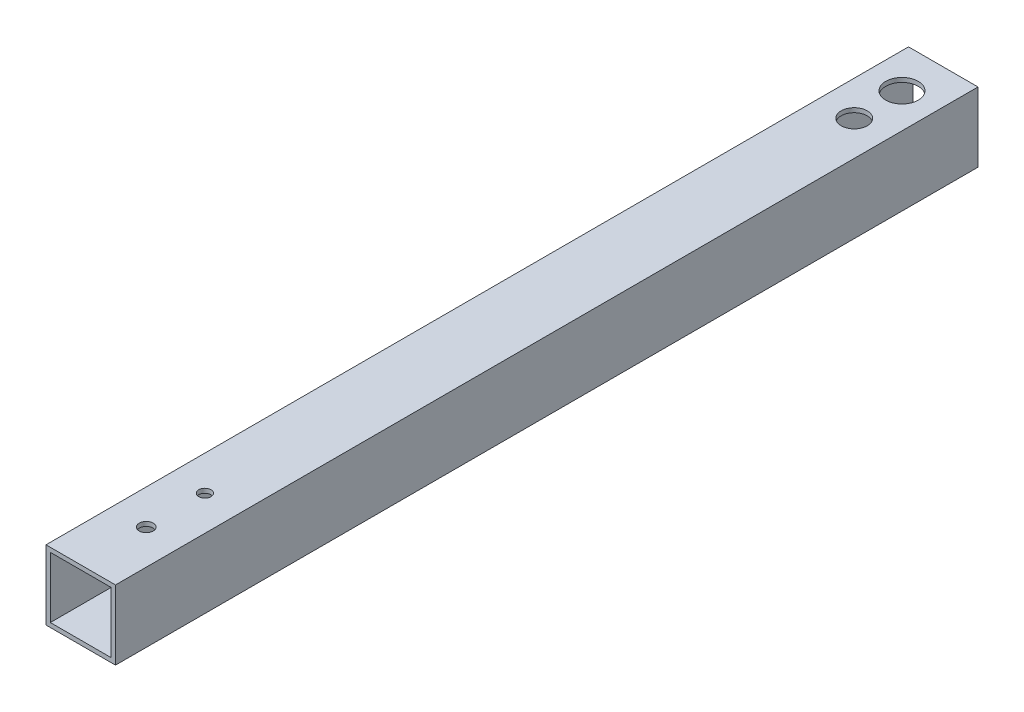
from build123d import *

# Parameters (mm, degrees)
SKETCH1_W           = 16
SKETCH1_H           = 16
SKETCH1_W_2         = 14
SKETCH1_H_2         = 14
BOSS_EXTRUDE1_DEPTH = 198.575758147
SKETCH2_R           = 3.75
SKETCH2_R_2         = 3
SKETCH2_R_3         = 1.4
SKETCH2_R_4         = 1.6
CUT_EXTRUDE1_DEPTH  = 200.3798679


with BuildPart() as part:
    # Sketch1 → Boss-Extrude1 (new body)
    with BuildSketch(Plane.XY):
        Rectangle(SKETCH1_W, SKETCH1_H)
        Rectangle(SKETCH1_W_2, SKETCH1_H_2, mode=Mode.SUBTRACT)
    extrude(amount=BOSS_EXTRUDE1_DEPTH)

    # Sketch2 → Cut-Extrude1 (cut, through all)
    with BuildSketch(Plane(origin=(0, 8, 0), x_dir=(1, 0, 0), z_dir=(0, 1, 0))):
        with Locations(Location((0, -9.5, 0), (0, 0, 270))):
            Circle(SKETCH2_R)
        with Locations(Location((0, -20.5, 0), (0, 0, 270))):
            Circle(SKETCH2_R_2)
        with Locations(Location((0, -170, 0), (0, 0, 270))):
            Circle(SKETCH2_R_3)
        with Locations(Location((0, -183.5, 0), (0, 0, 270))):
            Circle(SKETCH2_R_4)
    extrude(amount=-CUT_EXTRUDE1_DEPTH, mode=Mode.SUBTRACT)


solid = part.part
